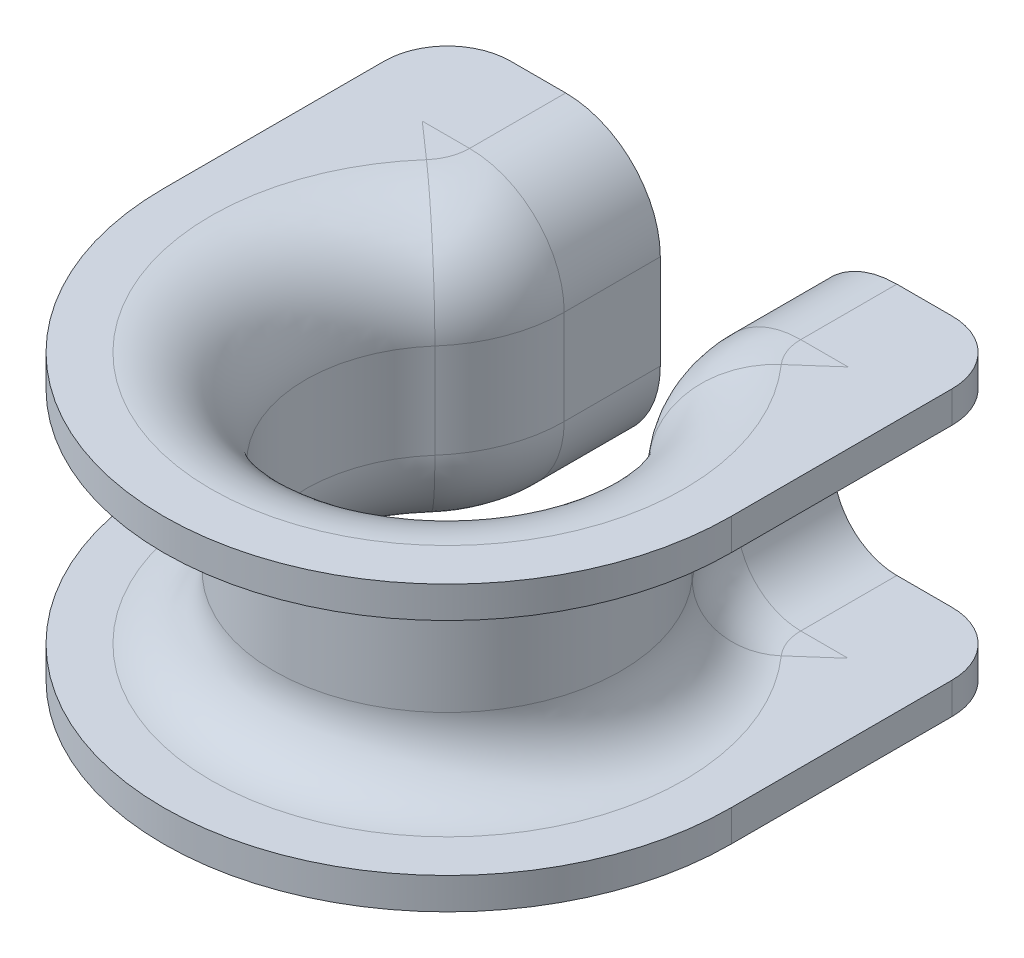
from build123d import *

# Parameters (mm, degrees)
BOSS_EXTRUDE1_START = -2
BOSS_EXTRUDE1_DEPTH = 2


with BuildPart() as part:
    # Sweep2: sweep along a path in Sketch2
    with BuildLine(Plane(origin=(0, 0, 0), x_dir=(1, 0, 0), z_dir=(0, 1, 0))) as sweep2_path:
        Line((-4.5, 18), (-4.5, 11.9058809))
        ThreePointArc((-4.5, 11.9058809), (-5.08127088, 8.723900384), (-6.75, 5.95294045))
        ThreePointArc((-6.75, 5.95294045), (0, -9), (6.75, 5.95294045))
        ThreePointArc((6.75, 5.95294045), (5.08127088, 8.723900384), (4.5, 11.9058809))
        Line((4.5, 11.9058809), (4.5, 18))
    # Sketch3 → Sweep2 (sweep)
    with BuildSketch(Plane(origin=(0, 0, 0), x_dir=(0, 0, -1), z_dir=(1, 0, 0))):
        with BuildLine():
            Line((-9, 3), (-9, -3))
            ThreePointArc((-9, -3), (-10.757359313, -7.242640687), (-15, -9))
            Line((-15, -9), (-18, -9))
            Line((-18, -9), (-18, -7))
            Line((-18, -7), (-15, -7))
            ThreePointArc((-15, -7), (-12.171572875, -5.828427125), (-11, -3))
            Line((-11, -3), (-11, 3))
            ThreePointArc((-11, 3), (-12.171572875, 5.828427125), (-15, 7))
            Line((-15, 7), (-18, 7))
            Line((-18, 7), (-18, 9))
            Line((-18, 9), (-15, 9))
            ThreePointArc((-15, 9), (-10.757359313, 7.242640687), (-9, 3))
        make_face()
    sweep(path=sweep2_path.line)

    # Sketch4 → Boss-Extrude1 (add)
    with BuildSketch(Plane(origin=(0, 9, 0), x_dir=(1, 0, 0), z_dir=(0, 1, 0)).offset(BOSS_EXTRUDE1_START)):
        with BuildLine():
            ThreePointArc((-13.5, 11.9058809), (-16.83745824, 6.363961031), (-18, 0))
            Line((-18, 0), (-18, 14))
            ThreePointArc((-18, 14), (-16.828427125, 16.828427125), (-14, 18))
            Line((-14, 18), (-13.5, 18))
            Line((-13.5, 18), (-13.5, 11.9058809))
        make_face()
        with BuildLine():
            Line((13.5, 18), (13.5, 11.9058809))
            ThreePointArc((13.5, 11.9058809), (16.83745824, 6.363961031), (18, 0))
            Line((18, 0), (18, 14))
            ThreePointArc((18, 14), (16.828427125, 16.828427125), (14, 18))
            Line((14, 18), (13.5, 18))
        make_face()
    boss_extrude1 = extrude(amount=BOSS_EXTRUDE1_DEPTH)

    # Mirror2: Boss-Extrude1 across plane
    add(boss_extrude1.mirror(Plane.ZX))


solid = part.part
